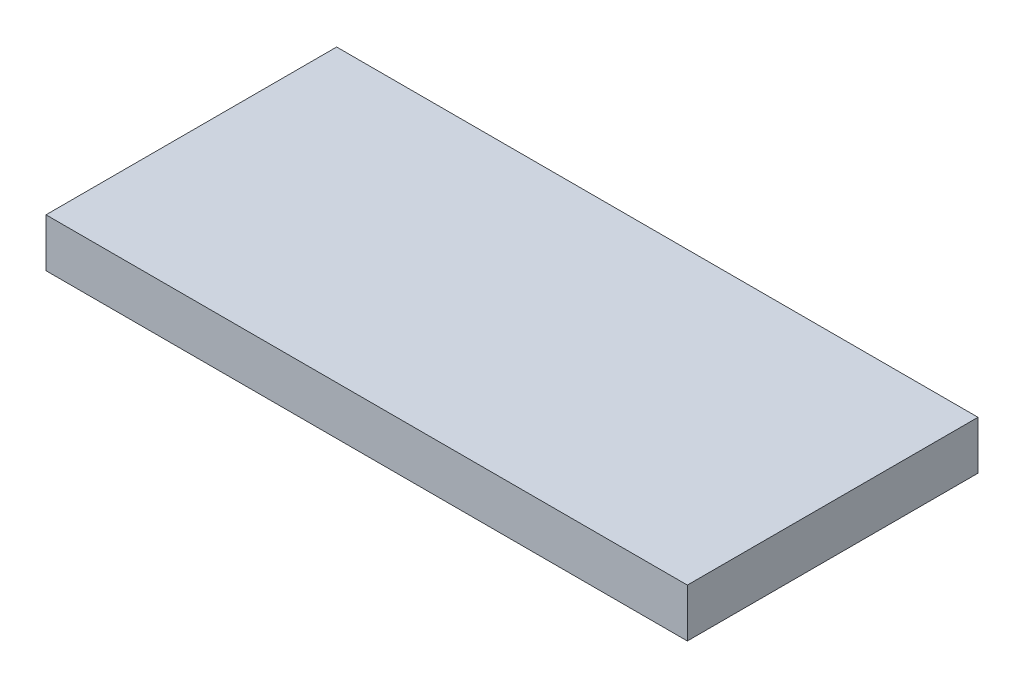
from build123d import *

# Parameters (mm, degrees)
SKETCH1_W           = 84.074
SKETCH1_H           = 38.1
BOSS_EXTRUDE1_DEPTH = 6.35


with BuildPart() as part:
    # Sketch1 → Boss-Extrude1 (new body)
    with BuildSketch(Plane(origin=(0, 0, 0), x_dir=(1, 0, 0), z_dir=(0, 1, 0))):
        with Locations((42.037, -19.05)):
            Rectangle(SKETCH1_W, SKETCH1_H)
    extrude(amount=BOSS_EXTRUDE1_DEPTH)


solid = part.part
